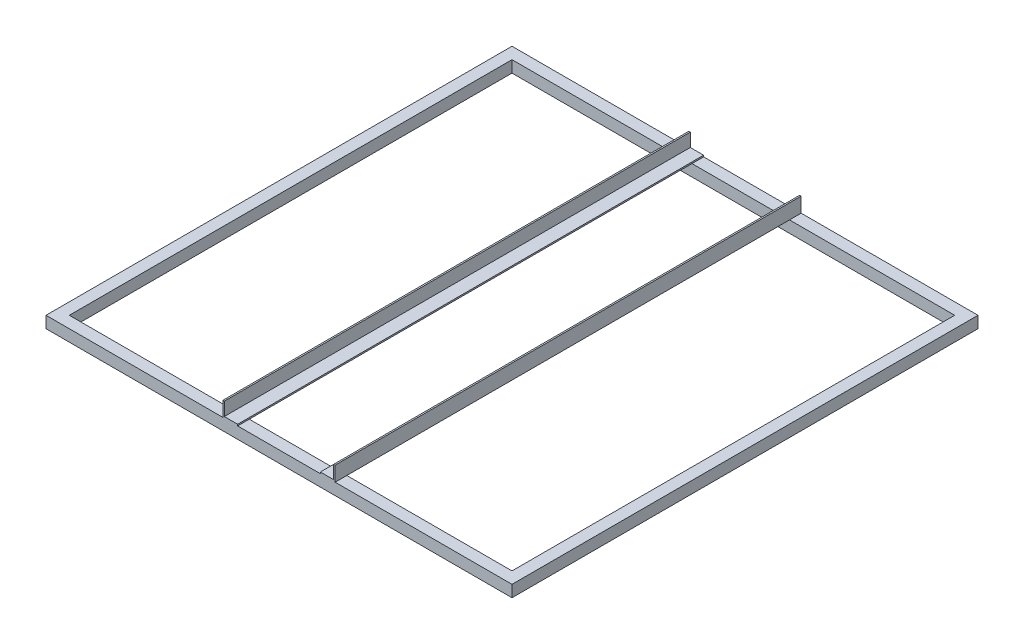
from build123d import *

# Parameters (mm, degrees)
SKETCH1_W           = 800
SKETCH1_H           = 800
SKETCH1_W_2         = 760
SKETCH1_H_2         = 760
BOSS_EXTRUDE1_DEPTH = 20
SKETCH2_W           = 25.4
SKETCH2_H           = 800
BOSS_EXTRUDE2_DEPTH = 2.5
SKETCH3_W           = 2.5
SKETCH3_H           = 800
BOSS_EXTRUDE3_DEPTH = 22.9


with BuildPart() as part:
    # Sketch1 → Boss-Extrude1 (new body)
    with BuildSketch(Plane(origin=(0, 0, 0), x_dir=(1, 0, 0), z_dir=(0, 1, 0))):
        Rectangle(SKETCH1_W, SKETCH1_H)
        Rectangle(SKETCH1_W_2, SKETCH1_H_2, mode=Mode.SUBTRACT)
    extrude(amount=BOSS_EXTRUDE1_DEPTH)

    # Sketch2 → Boss-Extrude2 (add)
    with BuildSketch(Plane(origin=(0, 20, 0), x_dir=(1, 0, 0), z_dir=(0, 1, 0))):
        with Locations((83.7, 0)):
            Rectangle(SKETCH2_W, SKETCH2_H)
        with Locations((-83.7, 0)):
            Rectangle(SKETCH2_W, SKETCH2_H)
    extrude(amount=BOSS_EXTRUDE2_DEPTH)

    # Sketch3 → Boss-Extrude3 (add)
    with BuildSketch(Plane(origin=(0, 22.5, 0), x_dir=(1, 0, 0), z_dir=(0, 1, 0))):
        with Locations((-95.15, 0)):
            Rectangle(SKETCH3_W, SKETCH3_H)
        with Locations((95.15, 0)):
            Rectangle(SKETCH3_W, SKETCH3_H)
    extrude(amount=BOSS_EXTRUDE3_DEPTH)


solid = part.part
